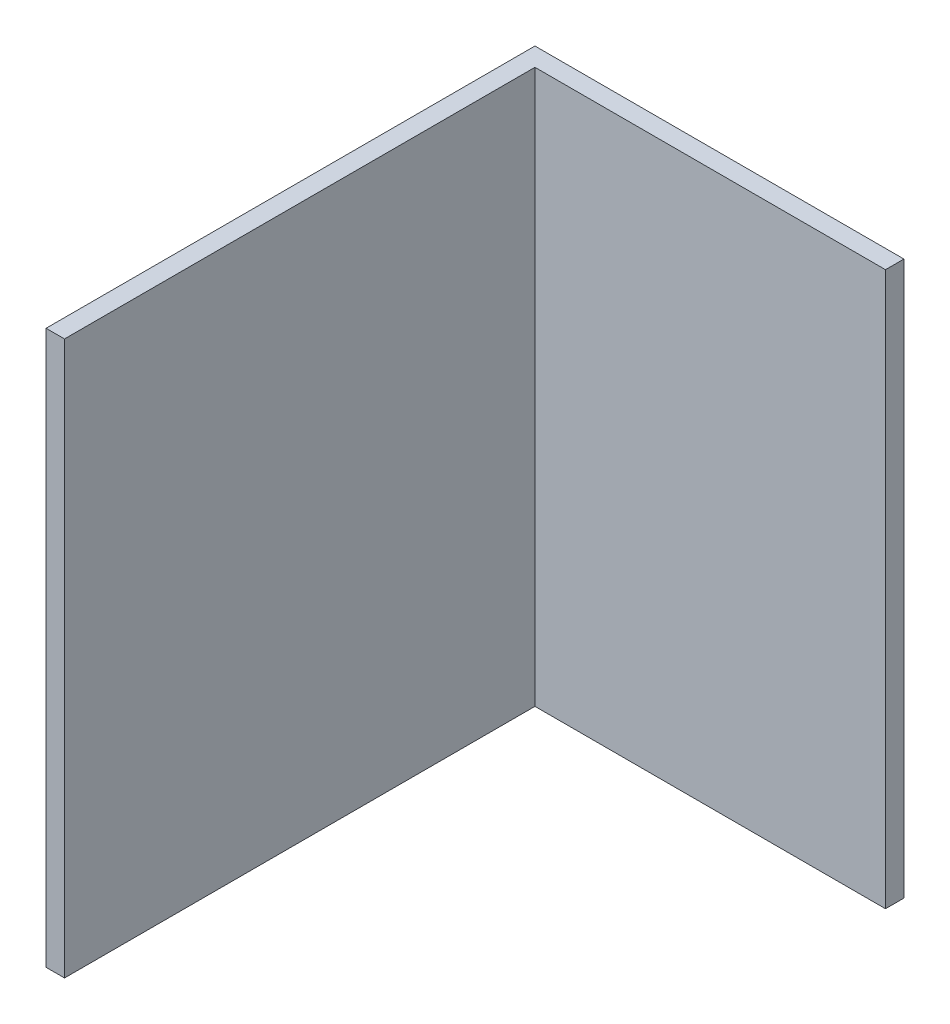
from build123d import *

# Parameters (mm, degrees)
BOSS_EXTRUDE1_DEPTH = 300


with BuildPart() as part:
    # Sketch1 → Boss-Extrude1 (new body)
    with BuildSketch(Plane(origin=(0, 0, 0), x_dir=(1, 0, 0), z_dir=(0, 1, 0))):
        Polygon((0, 0), (0, -265), (10, -265), (10, -10), (200, -10), (200, 0), align=None)
    extrude(amount=BOSS_EXTRUDE1_DEPTH)


solid = part.part
